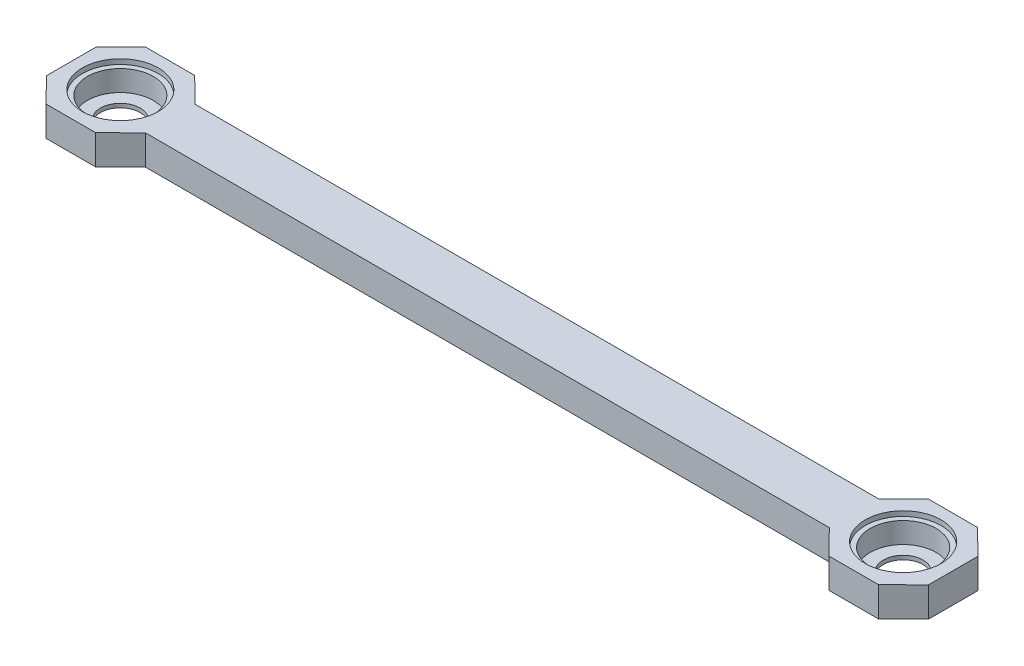
from build123d import *

# Parameters (mm, degrees)
SKETCH_1_R          = 4
EXTRUDE_1_DEPTH     = 6
SKETCH_2_R          = 6.65
CUT_EXTRUDE_1_DEPTH = 5.2
SKETCH_3_R          = 7.65
CUT_EXTRUDE_2_DEPTH = 1


with BuildPart() as part:
    # 草图1 → 凸台-拉伸1 (new body)
    with BuildSketch(Plane(origin=(0, 0, 0), x_dir=(1, 0, 0), z_dir=(0, 1, 0))):
        Polygon((-65.26232397, 5), (-70.363344484, 10), (-80.363344484, 10), (-85.26232397, 5), (-85.26232397, -5), (-80.363344484, -10), (-70.363344484, -10), (-65.26232397, -5), (72.73767603, -5), (77.636655516, -10), (87.636655516, -10), (92.739759147, -5), (92.739759147, 5), (87.636655516, 10), (77.636655516, 10), (72.73767603, 5), align=None)
        with Locations(Location((-75.363344484, 0, 0), (0, 0, 270))):
            Circle(SKETCH_1_R, mode=Mode.SUBTRACT)
        with Locations(Location((82.636655516, 0, 0), (0, 0, 270))):
            Circle(SKETCH_1_R, mode=Mode.SUBTRACT)
    extrude(amount=EXTRUDE_1_DEPTH)

    # 草图2 → 切除-拉伸1 (cut)
    with BuildSketch(Plane(origin=(0, 6, 0), x_dir=(1, 0, 0), z_dir=(0, 1, 0))):
        with Locations(Location((82.636655516, 0, 0), (0, 0, 270))):
            Circle(SKETCH_2_R)
        with Locations(Location((-75.363344484, 0, 0), (0, 0, 270))):
            Circle(SKETCH_2_R)
    extrude(amount=-CUT_EXTRUDE_1_DEPTH, mode=Mode.SUBTRACT)

    # 草图3 → 切除-拉伸2 (cut)
    with BuildSketch(Plane(origin=(0, 6, 0), x_dir=(1, 0, 0), z_dir=(0, 1, 0))):
        with Locations(Location((82.636655516, 0, 0), (0, 0, 270))):
            Circle(SKETCH_3_R)
        with Locations(Location((-75.363344484, 0, 0), (0, 0, 270))):
            Circle(SKETCH_3_R)
    extrude(amount=-CUT_EXTRUDE_2_DEPTH, mode=Mode.SUBTRACT)


solid = part.part
